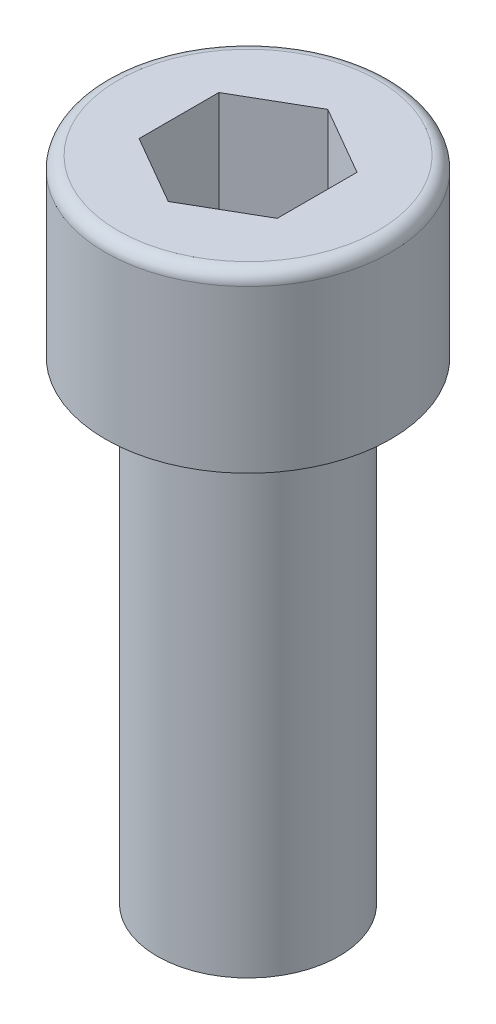
from build123d import *

# Parameters (mm, degrees)
SKETCH1_R           = 1.8288
BOSS_EXTRUDE1_DEPTH = 9.525
SKETCH2_R           = 2.8702
BOSS_EXTRUDE2_DEPTH = 3.5052
FILLET1_R           = 0.254
CUT_EXTRUDE1_DEPTH  = 2.54


with BuildPart() as part:
    # Sketch1 → Boss-Extrude1 (new body)
    with BuildSketch(Plane(origin=(0, 0, 0), x_dir=(1, 0, 0), z_dir=(0, 1, 0))):
        with Locations(Location((0, 0, 0), (0, 0, 270))):
            Circle(SKETCH1_R)
    extrude(amount=-BOSS_EXTRUDE1_DEPTH)

    # Sketch2 → Boss-Extrude2 (add)
    with BuildSketch(Plane(origin=(0, 0, 0), x_dir=(1, 0, 0), z_dir=(0, 1, 0))):
        with Locations(Location((0, 0, 0), (0, 0, 270))):
            Circle(SKETCH2_R)
    extrude(amount=BOSS_EXTRUDE2_DEPTH)

    # Fillet1
    fillet1_edges = [part.edges().sort_by_distance(p)[0] for p in [
        (0, 3.5052, -2.8702),
    ]]
    fillet(fillet1_edges, radius=FILLET1_R)

    # Sketch3 → Cut-Extrude1 (cut)
    with BuildSketch(Plane(origin=(0, 3.5052, 0), x_dir=(1, 0, 0), z_dir=(0, 1, 0))):
        Polygon((0, 1.603951217), (-1.3890625, 0.801975608), (-1.3890625, -0.801975608), (0, -1.603951217), (1.3890625, -0.801975608), (1.3890625, 0.801975608), align=None)
    extrude(amount=-CUT_EXTRUDE1_DEPTH, mode=Mode.SUBTRACT)


solid = part.part
